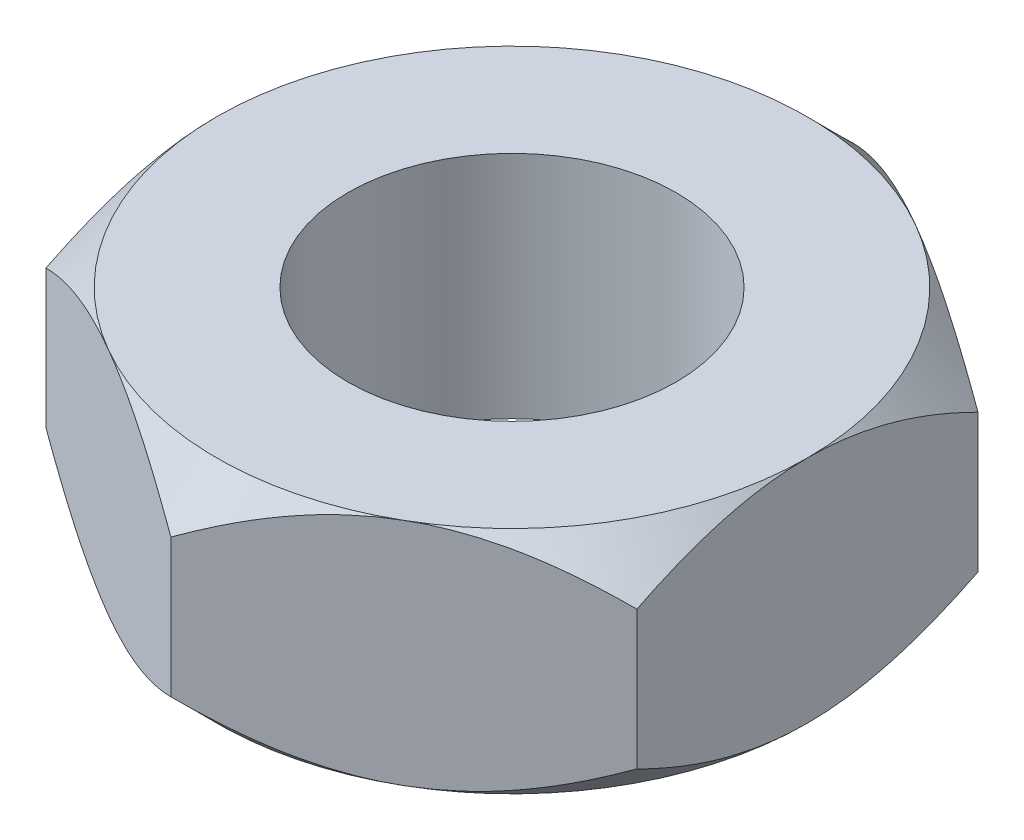
from build123d import *

# Parameters (mm, degrees)
SKETCH1_R           = 2.5
BOSS_EXTRUDE1_DEPTH = 1.75


with BuildPart() as part:
    # Sketch1 → Boss-Extrude1 (new, symmetric)
    with BuildSketch(Plane(origin=(0, 0, 0), x_dir=(1, 0, 0), z_dir=(0, 1, 0))):
        Polygon((0, 5.196152423), (-4.5, 2.598076211), (-4.5, -2.598076211), (0, -5.196152423), (4.5, -2.598076211), (4.5, 2.598076211), align=None)
        with Locations(Location((0, 0, 0), (0, 0, 270))):
            Circle(SKETCH1_R, mode=Mode.SUBTRACT)
    extrude(amount=BOSS_EXTRUDE1_DEPTH, both=True)

    # Cut-Sweep1: sweep along a path in Sketch2
    with BuildLine(Plane(origin=(0, 1.75, 0), x_dir=(1, 0, 0), z_dir=(0, 1, 0))) as cut_sweep1_path:
        CenterArc((0, 0), 4.5, 0, 360)
    # Sketch3 → Cut-Sweep1 (sweep, cut)
    with BuildSketch(Plane.XY):
        Polygon((-5.25, 1), (-4.5, 1.75), (-5.25, 1.75), align=None)
    cut_sweep1 = sweep(path=cut_sweep1_path.line, mode=Mode.SUBTRACT)

    # Mirror1: Cut-Sweep1 across plane
    add(cut_sweep1.mirror(Plane.ZX), mode=Mode.SUBTRACT)


solid = part.part
